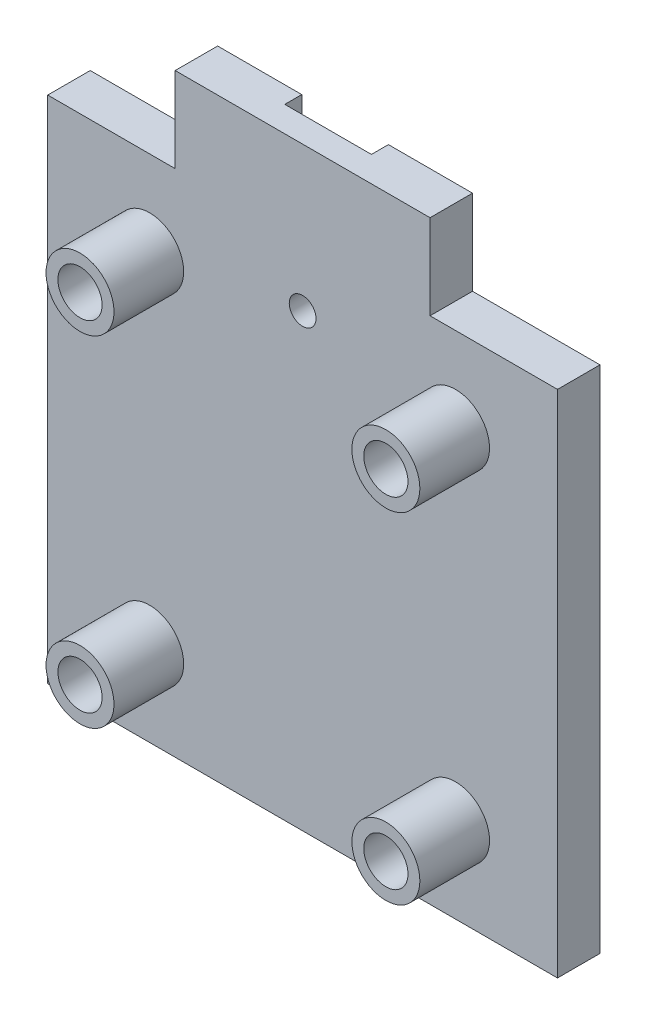
from build123d import *

# Parameters (mm, degrees)
SKETCH1_W           = 38.1
SKETCH1_H           = 76.2
BOSS_EXTRUDE1_DEPTH = 6.35
SKETCH8_W           = 19.05
SKETCH8_H           = 76.2
BOSS_EXTRUDE5_DEPTH = 6.35
SKETCH5_R           = 5.08
BOSS_EXTRUDE2_DEPTH = 10.414
SKETCH6_R           = 3.302
CUT_EXTRUDE3_DEPTH  = 57.429174157
SKETCH7_W           = 38.1
SKETCH7_H           = 12.7
BOSS_EXTRUDE4_DEPTH = 6.35
SKETCH9_R           = 2
CUT_EXTRUDE4_DEPTH  = 66.675579145
SKETCH10_W          = 12.954
SKETCH10_H          = 26.13
CUT_EXTRUDE5_DEPTH  = 2.54


with BuildPart() as part:
    # Sketch1 → Boss-Extrude1 (new body)
    with BuildSketch(Plane.XY):
        Rectangle(SKETCH1_W, SKETCH1_H)
    extrude(amount=BOSS_EXTRUDE1_DEPTH)

    # Sketch8 → Boss-Extrude5 (add)
    with BuildSketch(Plane.XY.offset(6.35)):
        with Locations((-28.575, 0)):
            Rectangle(SKETCH8_W, SKETCH8_H)
        with Locations((28.575, 0)):
            Rectangle(SKETCH8_W, SKETCH8_H)
    extrude(amount=-BOSS_EXTRUDE5_DEPTH)

    # Sketch5 → Boss-Extrude2 (add)
    with BuildSketch(Plane.XY.offset(6.35)):
        with Locations(Location((22.86, 25.4, 0), (0, 0, 180))):
            Circle(SKETCH5_R)
        with Locations(Location((-22.86, 25.4, 0), (0, 0, 180))):
            Circle(SKETCH5_R)
    boss_extrude2 = extrude(amount=BOSS_EXTRUDE2_DEPTH)

    # Sketch6 → Cut-Extrude3 (cut, through all)
    with BuildSketch(Plane.XY.offset(16.764)):
        with Locations((22.86, 25.4)):
            Circle(SKETCH6_R)
        with Locations(Location((-22.86, 25.4, 0), (0, 0, 180))):
            Circle(SKETCH6_R)
    cut_extrude3 = extrude(amount=-CUT_EXTRUDE3_DEPTH, mode=Mode.SUBTRACT)

    # Mirror1: Boss-Extrude2, Cut-Extrude3 across plane
    add(boss_extrude2.mirror(Plane.ZX))
    add(cut_extrude3.mirror(Plane.ZX), mode=Mode.SUBTRACT)

    # Sketch7 → Boss-Extrude4 (add)
    with BuildSketch(Plane.XY.offset(6.35)):
        with Locations((0, 44.45)):
            Rectangle(SKETCH7_W, SKETCH7_H)
    extrude(amount=-BOSS_EXTRUDE4_DEPTH)

    # Sketch9 → Cut-Extrude4 (cut, through all)
    with BuildSketch(Plane(origin=(0, 0, 0), x_dir=(-1, 0, 0), z_dir=(0, 0, -1))):
        with Locations((0, 29.21)):
            Circle(SKETCH9_R)
    extrude(amount=-CUT_EXTRUDE4_DEPTH, mode=Mode.SUBTRACT)

    # Sketch10 → Cut-Extrude5 (cut)
    with BuildSketch(Plane.XY):
        with Locations((0, 37.735)):
            Rectangle(SKETCH10_W, SKETCH10_H)
    extrude(amount=CUT_EXTRUDE5_DEPTH, mode=Mode.SUBTRACT)


solid = part.part
